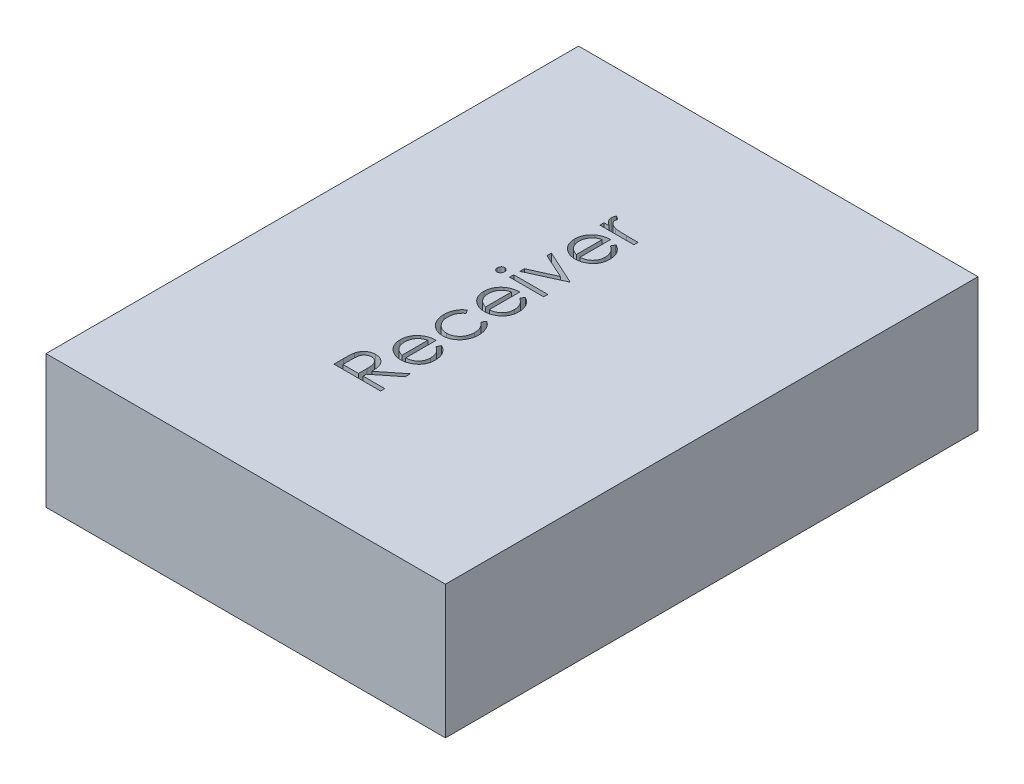
from build123d import *

# Parameters (mm, degrees)
SKETCH1_W           = 30
SKETCH1_H           = 40
BOSS_EXTRUDE1_DEPTH = 10
SKETCH2_W           = 2.557692308
SKETCH2_H           = 0.314102564
CUT_EXTRUDE1_DEPTH  = 2


with BuildPart() as part:
    # Sketch1 → Boss-Extrude1 (new body)
    with BuildSketch(Plane(origin=(0, 0, 0), x_dir=(1, 0, 0), z_dir=(0, 1, 0))):
        Rectangle(SKETCH1_W, SKETCH1_H)
    extrude(amount=BOSS_EXTRUDE1_DEPTH)

    # Sketch2 → Cut-Extrude1 (cut)
    # profile 1 of 9: a face of its own
    with BuildSketch(Plane(origin=(0, 10, 0), x_dir=(1, 0, 0), z_dir=(0, 1, 0))):
        with BuildLine():
            Line((-3.5, -9.871794872), (-3.5, -9.171374199))
            add(Edge.make_bspline(
                [(-3.5, -9.171374199), (-3.499844414, -9.12463307), (-3.499545672, -9.034884926), (-3.497879909, -8.906311655), (-3.493105553, -8.789484558), (-3.48899697, -8.684464719), (-3.481505028, -8.591254064), (-3.474344381, -8.509566773), (-3.46497072, -8.439779076), (-3.456265297, -8.397533225), (-3.452323718, -8.378405449)],
                knots=[0, 0, 0, 0, 1.410062039, 2.707475311, 3.878576406, 4.937260626, 5.877586885, 6.699081471, 7.410979367, 8, 8, 8, 8], degree=3))
            add(Edge.make_bspline(
                [(-3.452323718, -8.378405449), (-3.445996936, -8.352798844), (-3.433478338, -8.302131894), (-3.407018985, -8.22918154), (-3.376398448, -8.159668281), (-3.340438053, -8.093874571), (-3.298850926, -8.032153209), (-3.252429037, -7.973780871), (-3.201266149, -7.918947036), (-3.144901045, -7.868367331), (-3.084534666, -7.822423199), (-3.020332688, -7.782123119), (-2.952560575, -7.748070292), (-2.881112765, -7.721347564), (-2.806778508, -7.698924258), (-2.728799111, -7.683858559), (-2.647434893, -7.674474101), (-2.592073564, -7.673547009), (-2.564002404, -7.673076923)],
                knots=[0, 0, 0, 0, 1.02737844, 2.032840108, 3.019645024, 3.985760442, 4.950801802, 5.916702504, 6.889791722, 7.870143693, 8.864820395, 9.842884691, 10.820524757, 11.815201459, 12.812418953, 13.84314332, 14.906358105, 16, 16, 16, 16], degree=3))
            add(Edge.make_bspline(
                [(-2.564002404, -7.673076923), (-2.517367299, -7.674545921), (-2.426370131, -7.677412317), (-2.29430925, -7.704137421), (-2.171119935, -7.74791394), (-2.056957297, -7.808237229), (-1.954046652, -7.885056705), (-1.863656197, -7.977381496), (-1.788016284, -8.085263108), (-1.735563479, -8.185692424), (-1.701970571, -8.274406623), (-1.678334212, -8.347439936), (-1.660072247, -8.427106914), (-1.643712115, -8.512644248), (-1.63136042, -8.604407904), (-1.622313826, -8.702177943), (-1.616659777, -8.806024095), (-1.615817772, -8.877363164), (-1.615384615, -8.9140625)],
                knots=[0, 0, 0, 0, 1.260483769, 2.459530307, 3.627416485, 4.787058657, 5.939039949, 7.08810263, 8.267026773, 9.491475466, 10.141966685, 10.831826277, 11.566392101, 12.351337768, 13.187381173, 14.07005841, 15.007169909, 16, 16, 16, 16], degree=3))
            Line((-1.615384615, -8.9140625), (0, -7.628205128))
            Line((0, -7.628205128), (0, -8.016626603))
            Line((0, -8.016626603), (-1.615384615, -9.302483974))
            Line((-1.615384615, -9.302483974), (-1.615384615, -9.557692308))
            Line((-1.615384615, -9.557692308), (0, -9.557692308))
            Line((0, -9.557692308), (0, -9.871794872))
            Line((0, -9.871794872), (-3.5, -9.871794872))
        make_face()
        with BuildLine():
            Line((-3.141025641, -9.557692308), (-1.974358974, -9.557692308))
            Line((-1.974358974, -9.557692308), (-1.969451122, -8.916866987))
            add(Edge.make_bspline(
                [(-1.969451122, -8.916866987), (-1.969437877, -8.886946944), (-1.969412206, -8.82895338), (-1.973406086, -8.745052768), (-1.97794905, -8.666932476), (-1.984899579, -8.594892323), (-1.993851764, -8.52889678), (-2.005067425, -8.468989787), (-2.018078178, -8.415037813), (-2.038424454, -8.352317992), (-2.069251682, -8.281453612), (-2.117131907, -8.206123258), (-2.174663519, -8.140026916), (-2.242349925, -8.086196354), (-2.31558868, -8.041095114), (-2.395129884, -8.010743773), (-2.478393298, -7.990515893), (-2.535601748, -7.988304445), (-2.564703526, -7.987179487)],
                knots=[0, 0, 0, 0, 1.146477201, 2.22219935, 3.21835465, 4.145220026, 4.995151787, 5.769831222, 6.480173269, 7.120302478, 8.295254187, 9.430763426, 10.528629691, 11.636497428, 12.733230534, 13.811001502, 14.886462612, 16, 16, 16, 16], degree=3))
            add(Edge.make_bspline(
                [(-2.564703526, -7.987179487), (-2.592847804, -7.988385078), (-2.648619495, -7.990774119), (-2.730309052, -8.010172021), (-2.807431576, -8.043334675), (-2.880086643, -8.086960293), (-2.945007947, -8.14171063), (-3.001158697, -8.204675162), (-3.047125816, -8.27584177), (-3.077677228, -8.341770783), (-3.095618725, -8.401171504), (-3.108659167, -8.45250054), (-3.11770972, -8.510782617), (-3.126282244, -8.575752687), (-3.133221934, -8.647534743), (-3.138008837, -8.726339169), (-3.140812263, -8.811677799), (-3.14095286, -8.870824463), (-3.141025641, -8.901442308)],
                knots=[0, 0, 0, 0, 1.100823979, 2.181431445, 3.263702604, 4.376021382, 5.48638238, 6.575013887, 7.666064109, 8.791843368, 9.405226397, 10.093019944, 10.863016055, 11.711746407, 12.658404307, 13.684961631, 14.801597923, 16, 16, 16, 16], degree=3))
            Line((-3.141025641, -8.901442308), (-3.141025641, -9.557692308))
        make_face(mode=Mode.SUBTRACT)
    # profile 2 of 9: a face of its own
    with BuildSketch(Plane(origin=(0, 10, 0), x_dir=(1, 0, 0), z_dir=(0, 1, 0))):
        with BuildLine():
            Line((-0.807692308, -4.900841346), (-0.661157853, -4.621794872))
            add(Edge.make_bspline(
                [(-0.661157853, -4.621794872), (-0.621723871, -4.644043133), (-0.54500096, -4.687329438), (-0.439586991, -4.761466361), (-0.345319457, -4.839894828), (-0.26370785, -4.925001106), (-0.191634668, -5.014220583), (-0.129467518, -5.109247813), (-0.07608468, -5.209307149), (-0.032342426, -5.315500693), (0.002045853, -5.427701236), (0.027441832, -5.546559846), (0.042169086, -5.672637728), (0.043956532, -5.758975691), (0.044871795, -5.803185096)],
                knots=[0, 0, 0, 0, 1.120611642, 2.180266485, 3.186550691, 4.152466804, 5.095166165, 6.022949561, 6.960161436, 7.899497276, 8.862391909, 9.862399089, 10.905440174, 12, 12, 12, 12], degree=3))
            add(Edge.make_bspline(
                [(0.044871795, -5.803185096), (0.04372462, -5.852327074), (0.041486813, -5.948188835), (0.022194349, -6.087728583), (-0.009278012, -6.219107998), (-0.053243547, -6.342319716), (-0.110670893, -6.457061915), (-0.180630295, -6.563562966), (-0.26276285, -6.66238175), (-0.357778154, -6.750408775), (-0.459464338, -6.829642211), (-0.565404947, -6.899605791), (-0.675233097, -6.95782552), (-0.788295336, -7.0059075), (-0.90433474, -7.04383507), (-1.024015882, -7.070786986), (-1.146864189, -7.086180135), (-1.229959798, -7.088549549), (-1.271834936, -7.08974359)],
                knots=[0, 0, 0, 0, 1.14524686, 2.234044844, 3.276713788, 4.290115724, 5.276966211, 6.260758605, 7.254862358, 8.264742877, 9.274005885, 10.257798278, 11.220590477, 12.167824544, 13.118936889, 14.062732937, 15.023735098, 16, 16, 16, 16], degree=3))
            add(Edge.make_bspline(
                [(-1.271834936, -7.08974359), (-1.311129766, -7.088684448), (-1.389006931, -7.08658537), (-1.504272476, -7.073354583), (-1.616300928, -7.04990629), (-1.725185376, -7.017729966), (-1.83074351, -6.97617872), (-1.933039574, -6.9253465), (-2.031964713, -6.865154123), (-2.094367847, -6.818681449), (-2.125801282, -6.795272436)],
                knots=[0, 0, 0, 0, 1.024358464, 2.0301432, 3.019427413, 4.004406732, 4.986367066, 5.972626655, 6.978780325, 8, 8, 8, 8], degree=3))
            add(Edge.make_bspline(
                [(-2.125801282, -6.795272436), (-2.163732941, -6.763619417), (-2.238272838, -6.70141774), (-2.335322662, -6.595120979), (-2.418340489, -6.481571199), (-2.486066597, -6.359626225), (-2.538158683, -6.229491466), (-2.575211094, -6.091838148), (-2.598266796, -5.9462858), (-2.601109889, -5.846508073), (-2.602564103, -5.795472756)],
                knots=[0, 0, 0, 0, 1.030811313, 2.025658015, 2.997072178, 3.962767568, 4.930766827, 5.917075773, 6.934604948, 8, 8, 8, 8], degree=3))
            add(Edge.make_bspline(
                [(-2.602564103, -5.795472756), (-2.601216835, -5.743022135), (-2.598573804, -5.640125973), (-2.573851652, -5.490136462), (-2.535122917, -5.347934556), (-2.478696987, -5.214693774), (-2.408753193, -5.088361073), (-2.320347513, -4.971843985), (-2.218020567, -4.86194404), (-2.13924476, -4.798042155), (-2.099158654, -4.76552484)],
                knots=[0, 0, 0, 0, 1.056389096, 2.072394598, 3.055233004, 4.020130009, 4.981825462, 5.957811105, 6.960805292, 8, 8, 8, 8], degree=3))
            add(Edge.make_bspline(
                [(-2.099158654, -4.76552484), (-2.068955072, -4.743397901), (-2.008748954, -4.699291308), (-1.910577797, -4.644044208), (-1.807867202, -4.596086813), (-1.698956905, -4.557753852), (-1.585137325, -4.526714351), (-1.46559478, -4.504257532), (-1.340364869, -4.491087914), (-1.255038314, -4.488499216), (-1.211538462, -4.487179487)],
                knots=[0, 0, 0, 0, 0.94817472, 1.890038105, 2.849395472, 3.817997239, 4.812318967, 5.836947057, 6.897266129, 8, 8, 8, 8], degree=3))
            Line((-1.211538462, -4.487179487), (-1.211538462, -6.775641026))
            add(Edge.make_bspline(
                [(-1.211538462, -6.775641026), (-1.177837997, -6.774101419), (-1.111567394, -6.771073845), (-1.01459661, -6.756958702), (-0.922223268, -6.734709928), (-0.835140226, -6.703440866), (-0.752210099, -6.66557402), (-0.674048062, -6.619188304), (-0.601010132, -6.56384875), (-0.532442994, -6.50212305), (-0.471382233, -6.433415955), (-0.416730457, -6.361133208), (-0.37092486, -6.284239643), (-0.33374497, -6.203341559), (-0.304638654, -6.118569774), (-0.284770834, -6.029897579), (-0.271463727, -5.937499463), (-0.269984061, -5.874513729), (-0.269230769, -5.842447917)],
                knots=[0, 0, 0, 0, 1.094153842, 2.151609401, 3.174256925, 4.172055639, 5.149267565, 6.128595816, 7.11444997, 8.118368179, 9.117203808, 10.09244225, 11.054858984, 12.015122123, 12.976791628, 13.957293641, 14.960065497, 16, 16, 16, 16], degree=3))
            add(Edge.make_bspline(
                [(-0.269230769, -5.842447917), (-0.269833929, -5.811095401), (-0.271030715, -5.748885996), (-0.282834755, -5.656265289), (-0.301543133, -5.564984469), (-0.328488888, -5.475949929), (-0.360042003, -5.390459236), (-0.397179816, -5.310852818), (-0.439521127, -5.238183111), (-0.487636723, -5.169998776), (-0.546687196, -5.104221369), (-0.61966842, -5.037936859), (-0.707408148, -4.968431135), (-0.773006325, -4.924219098), (-0.807692308, -4.900841346)],
                knots=[0, 0, 0, 0, 0.991168677, 1.966668791, 2.94808785, 3.9350306, 4.905702032, 5.828266021, 6.709360349, 7.562606342, 8.463112863, 9.498839253, 10.677475166, 12, 12, 12, 12], degree=3))
        make_face()
        with BuildLine():
            add(Edge.make_bspline(
                [(-1.525641026, -4.801282051), (-1.567324719, -4.812732119), (-1.647343869, -4.83471253), (-1.75811233, -4.881523635), (-1.857124106, -4.932971684), (-1.942733842, -4.994905012), (-2.018888471, -5.06439183), (-2.084375044, -5.145762573), (-2.144732764, -5.2354881), (-2.194996376, -5.335355562), (-2.236300966, -5.441426684), (-2.266672607, -5.551521284), (-2.284525968, -5.664717221), (-2.287143515, -5.740957428), (-2.288461538, -5.779346955)],
                knots=[0, 0, 0, 0, 1.155085888, 2.217389643, 3.210301801, 4.133263417, 5.03575695, 5.95948047, 6.920061569, 7.923798377, 8.943125483, 9.960783337, 10.973185325, 12, 12, 12, 12], degree=3))
            add(Edge.make_bspline(
                [(-2.288461538, -5.779346955), (-2.287857, -5.810698789), (-2.286661954, -5.872674774), (-2.275088768, -5.96394123), (-2.256491944, -6.051816562), (-2.229148178, -6.136038468), (-2.195876219, -6.217165622), (-2.154978249, -6.295139403), (-2.105531888, -6.368957443), (-2.067760071, -6.415093615), (-2.048677885, -6.438401442)],
                knots=[0, 0, 0, 0, 1.048823158, 2.073302879, 3.073550078, 4.050623576, 5.03253758, 6.005186856, 6.992227572, 8, 8, 8, 8], degree=3))
            add(Edge.make_bspline(
                [(-2.048677885, -6.438401442), (-2.033585155, -6.45509734), (-2.00304115, -6.488885769), (-1.950387182, -6.533985457), (-1.893576633, -6.577488847), (-1.83012967, -6.616147948), (-1.761886187, -6.652887684), (-1.688348228, -6.68636711), (-1.609205387, -6.716808154), (-1.554028674, -6.733896557), (-1.525641026, -6.742688301)],
                knots=[0, 0, 0, 0, 0.879905587, 1.780714457, 2.708106151, 3.677566983, 4.684151534, 5.740052498, 6.837288539, 8, 8, 8, 8], degree=3))
            Line((-1.525641026, -6.742688301), (-1.525641026, -4.801282051))
        make_face(mode=Mode.SUBTRACT)
    # profile 3 of 9: a face of its own
    with BuildSketch(Plane(origin=(0, 10, 0), x_dir=(1, 0, 0), z_dir=(0, 1, 0))):
        with BuildLine():
            Line((-2.003104968, -1.346153846), (-1.83974359, -1.609074519))
            add(Edge.make_bspline(
                [(-1.83974359, -1.609074519), (-1.875571984, -1.637904385), (-1.946094094, -1.69465108), (-2.037104027, -1.793190316), (-2.115271069, -1.89820173), (-2.17897482, -2.011479778), (-2.22819627, -2.132865578), (-2.263026476, -2.261880429), (-2.284730719, -2.398505934), (-2.287197555, -2.492171133), (-2.288461538, -2.540164263)],
                knots=[0, 0, 0, 0, 1.026593902, 2.0206758, 2.988051866, 3.946915611, 4.916868779, 5.907761954, 6.927957743, 8, 8, 8, 8], degree=3))
            add(Edge.make_bspline(
                [(-2.288461538, -2.540164263), (-2.287404696, -2.57852322), (-2.285323274, -2.654070142), (-2.272312781, -2.764976296), (-2.248670773, -2.870618649), (-2.217519816, -2.971659358), (-2.175769526, -3.067379776), (-2.12495977, -3.158030695), (-2.06590973, -3.244416185), (-1.997499184, -3.324032926), (-1.923100516, -3.396861933), (-1.843346821, -3.459960847), (-1.76062693, -3.51489778), (-1.672875188, -3.558003737), (-1.582099134, -3.593278907), (-1.486585279, -3.616485627), (-1.387557271, -3.631950323), (-1.320038931, -3.633719652), (-1.285857372, -3.634615385)],
                knots=[0, 0, 0, 0, 1.112346261, 2.190735716, 3.231507886, 4.247384806, 5.251966152, 6.253067467, 7.256802811, 8.280671706, 9.291813951, 10.270744147, 11.225547591, 12.165006084, 13.100104208, 14.043489273, 15.009504848, 16, 16, 16, 16], degree=3))
            add(Edge.make_bspline(
                [(-1.285857372, -3.634615385), (-1.241094559, -3.632809166), (-1.151943011, -3.629211824), (-1.020567246, -3.60185125), (-0.89378287, -3.556069802), (-0.772275303, -3.494221188), (-0.65969093, -3.415714574), (-0.558704882, -3.323549825), (-0.471289548, -3.217628652), (-0.398816831, -3.098896897), (-0.340555516, -2.970138995), (-0.299048169, -2.832748934), (-0.273995801, -2.687849141), (-0.270839857, -2.588642396), (-0.269230769, -2.538060897)],
                knots=[0, 0, 0, 0, 0.96628757, 1.924499989, 2.884001032, 3.87047137, 4.860396324, 5.839257425, 6.814467993, 7.816059692, 8.834901047, 9.858382822, 10.908076205, 12, 12, 12, 12], degree=3))
            add(Edge.make_bspline(
                [(-0.269230769, -2.538060897), (-0.270530266, -2.491705713), (-0.273084123, -2.400605475), (-0.294613087, -2.26743819), (-0.32985672, -2.140658279), (-0.37900437, -2.020270248), (-0.442531886, -1.906494082), (-0.520891057, -1.800064907), (-0.611827657, -1.698864969), (-0.682145629, -1.639367992), (-0.717948718, -1.609074519)],
                knots=[0, 0, 0, 0, 1.039848629, 2.043578496, 3.018386758, 3.987534228, 4.954977003, 5.934852016, 6.948509513, 8, 8, 8, 8], degree=3))
            Line((-0.717948718, -1.609074519), (-0.545472756, -1.346153846))
            add(Edge.make_bspline(
                [(-0.545472756, -1.346153846), (-0.522582029, -1.361741548), (-0.476876553, -1.392865215), (-0.412432436, -1.444892841), (-0.352110754, -1.501012672), (-0.295992364, -1.561005769), (-0.242734345, -1.624088779), (-0.19488277, -1.692416689), (-0.149747947, -1.7637863), (-0.109135075, -1.839035458), (-0.072628754, -1.917386156), (-0.041237583, -1.998728146), (-0.014267477, -2.082707958), (0.00716987, -2.169424334), (0.024280708, -2.259048233), (0.03563441, -2.351347867), (0.044109691, -2.446291449), (0.044615558, -2.5104636), (0.044871795, -2.54296875)],
                knots=[0, 0, 0, 0, 0.954134338, 1.905101784, 2.851144739, 3.791306361, 4.734911809, 5.6936923, 6.663572882, 7.643865596, 8.638447847, 9.640600242, 10.646758161, 11.676244097, 12.717260333, 13.78922464, 14.880174919, 16, 16, 16, 16], degree=3))
            add(Edge.make_bspline(
                [(0.044871795, -2.54296875), (0.043979034, -2.592578985), (0.042229217, -2.689815405), (0.023041632, -2.832147069), (-0.005991844, -2.968127486), (-0.047309347, -3.097995621), (-0.101873852, -3.22095751), (-0.166998533, -3.338036815), (-0.244835572, -3.448025355), (-0.333535822, -3.550202081), (-0.429805581, -3.643642664), (-0.533088574, -3.724950666), (-0.641102547, -3.793856658), (-0.754528339, -3.850619162), (-0.87290085, -3.895002144), (-0.996943228, -3.925558247), (-1.125603037, -3.945274082), (-1.213334882, -3.947559371), (-1.2578125, -3.948717949)],
                knots=[0, 0, 0, 0, 1.113096611, 2.181677437, 3.217994567, 4.231807234, 5.234933164, 6.233258928, 7.234764453, 8.254006763, 9.267004511, 10.242118657, 11.199842941, 12.138404996, 13.084707599, 14.031460992, 15.002005182, 16, 16, 16, 16], degree=3))
            add(Edge.make_bspline(
                [(-1.2578125, -3.948717949), (-1.287990935, -3.948276933), (-1.348020822, -3.947399679), (-1.437115889, -3.937337751), (-1.525024434, -3.924339278), (-1.610632153, -3.902313541), (-1.695237443, -3.876872909), (-1.777820545, -3.844397377), (-1.858765217, -3.806301983), (-1.937862947, -3.763050035), (-2.013812487, -3.71436129), (-2.085566151, -3.660480057), (-2.153985917, -3.603435721), (-2.216709677, -3.540559609), (-2.276245869, -3.474519955), (-2.331003993, -3.403448379), (-2.381144984, -3.327752527), (-2.427595999, -3.248569205), (-2.468955434, -3.165944494), (-2.504588672, -3.080377823), (-2.535041248, -2.992384794), (-2.559150167, -2.90182465), (-2.579367591, -2.809298477), (-2.592085437, -2.714077139), (-2.60107171, -2.616524916), (-2.602062502, -2.550468894), (-2.602564103, -2.517027244)],
                knots=[0, 0, 0, 0, 0.990994727, 1.971252077, 2.943264845, 3.907940874, 4.872158414, 5.844625996, 6.82015047, 7.809835459, 8.804511986, 9.781214284, 10.756496977, 11.728388426, 12.696359165, 13.676225489, 14.672885716, 15.677705647, 16.690706858, 17.706033469, 18.721040654, 19.747369689, 20.783475414, 21.830280724, 22.901553713, 24, 24, 24, 24], degree=3))
            add(Edge.make_bspline(
                [(-2.602564103, -2.517027244), (-2.601642307, -2.475147083), (-2.599803323, -2.3915961), (-2.584323254, -2.267656166), (-2.560992168, -2.145538065), (-2.526399552, -2.027401753), (-2.484607014, -1.91461645), (-2.43739326, -1.809320902), (-2.38372785, -1.71310528), (-2.323939338, -1.62512091), (-2.255830681, -1.54539217), (-2.180095138, -1.471875587), (-2.096187562, -1.404086791), (-2.034388568, -1.3656242), (-2.003104968, -1.346153846)],
                knots=[0, 0, 0, 0, 1.095139042, 2.184804066, 3.262657822, 4.34424993, 5.400369085, 6.407210964, 7.359649996, 8.278719237, 9.185177137, 10.097389079, 11.036869154, 12, 12, 12, 12], degree=3))
        make_face()
    # profile 4 of 9: a face of its own
    with BuildSketch(Plane(origin=(0, 10, 0), x_dir=(1, 0, 0), z_dir=(0, 1, 0))):
        with BuildLine():
            Line((-0.807692308, 1.381209936), (-0.661157853, 1.66025641))
            add(Edge.make_bspline(
                [(-0.661157853, 1.66025641), (-0.621723871, 1.638008149), (-0.54500096, 1.594721844), (-0.439586991, 1.520584921), (-0.345319457, 1.442156454), (-0.26370785, 1.357050176), (-0.191634668, 1.267830699), (-0.129467518, 1.172803469), (-0.07608468, 1.072744133), (-0.032342426, 0.966550589), (0.002045853, 0.854350046), (0.027441832, 0.735491436), (0.042169086, 0.609413554), (0.043956532, 0.523075591), (0.044871795, 0.478866186)],
                knots=[0, 0, 0, 0, 1.120611642, 2.180266485, 3.186550691, 4.152466804, 5.095166165, 6.022949561, 6.960161436, 7.899497276, 8.862391909, 9.862399089, 10.905440174, 12, 12, 12, 12], degree=3))
            add(Edge.make_bspline(
                [(0.044871795, 0.478866186), (0.04372462, 0.429724208), (0.041486813, 0.333862447), (0.022194349, 0.194322699), (-0.009278012, 0.062943284), (-0.053243547, -0.060268434), (-0.110670893, -0.175010633), (-0.180630295, -0.281511684), (-0.26276285, -0.380330468), (-0.357778154, -0.468357493), (-0.459464338, -0.547590929), (-0.565404947, -0.617554509), (-0.675233097, -0.675774238), (-0.788295336, -0.723856218), (-0.90433474, -0.761783788), (-1.024015882, -0.788735704), (-1.146864189, -0.804128853), (-1.229959798, -0.806498267), (-1.271834936, -0.807692308)],
                knots=[0, 0, 0, 0, 1.14524686, 2.234044844, 3.276713788, 4.290115724, 5.276966211, 6.260758605, 7.254862358, 8.264742877, 9.274005885, 10.257798278, 11.220590477, 12.167824544, 13.118936889, 14.062732937, 15.023735098, 16, 16, 16, 16], degree=3))
            add(Edge.make_bspline(
                [(-1.271834936, -0.807692308), (-1.311129766, -0.806633166), (-1.389006931, -0.804534088), (-1.504272476, -0.791303301), (-1.616300928, -0.767855008), (-1.725185376, -0.735678684), (-1.83074351, -0.694127438), (-1.933039574, -0.643295218), (-2.031964713, -0.583102841), (-2.094367847, -0.536630167), (-2.125801282, -0.513221154)],
                knots=[0, 0, 0, 0, 1.024358464, 2.0301432, 3.019427413, 4.004406732, 4.986367066, 5.972626655, 6.978780325, 8, 8, 8, 8], degree=3))
            add(Edge.make_bspline(
                [(-2.125801282, -0.513221154), (-2.163732941, -0.481568135), (-2.238272838, -0.419366458), (-2.335322662, -0.313069697), (-2.418340489, -0.199519917), (-2.486066597, -0.077574943), (-2.538158683, 0.052559816), (-2.575211094, 0.190213134), (-2.598266796, 0.335765482), (-2.601109889, 0.435543209), (-2.602564103, 0.486578526)],
                knots=[0, 0, 0, 0, 1.030811313, 2.025658015, 2.997072178, 3.962767568, 4.930766827, 5.917075773, 6.934604948, 8, 8, 8, 8], degree=3))
            add(Edge.make_bspline(
                [(-2.602564103, 0.486578526), (-2.601216835, 0.539029147), (-2.598573804, 0.641925309), (-2.573851652, 0.79191482), (-2.535122917, 0.934116726), (-2.478696987, 1.067357508), (-2.408753193, 1.193690209), (-2.320347513, 1.310207297), (-2.218020567, 1.420107242), (-2.13924476, 1.484009127), (-2.099158654, 1.516526442)],
                knots=[0, 0, 0, 0, 1.056389096, 2.072394598, 3.055233004, 4.020130009, 4.981825462, 5.957811105, 6.960805292, 8, 8, 8, 8], degree=3))
            add(Edge.make_bspline(
                [(-2.099158654, 1.516526442), (-2.068955072, 1.538653381), (-2.008748954, 1.582759974), (-1.910577797, 1.638007074), (-1.807867202, 1.685964469), (-1.698956905, 1.72429743), (-1.585137325, 1.755336931), (-1.46559478, 1.77779375), (-1.340364869, 1.790963368), (-1.255038314, 1.793552066), (-1.211538462, 1.794871795)],
                knots=[0, 0, 0, 0, 0.94817472, 1.890038105, 2.849395472, 3.817997239, 4.812318967, 5.836947057, 6.897266129, 8, 8, 8, 8], degree=3))
            Line((-1.211538462, 1.794871795), (-1.211538462, -0.493589744))
            add(Edge.make_bspline(
                [(-1.211538462, -0.493589744), (-1.177837997, -0.492050137), (-1.111567394, -0.489022563), (-1.01459661, -0.47490742), (-0.922223268, -0.452658646), (-0.835140226, -0.421389584), (-0.752210099, -0.383522738), (-0.674048062, -0.337137022), (-0.601010132, -0.281797468), (-0.532442994, -0.220071768), (-0.471382233, -0.151364673), (-0.416730457, -0.079081926), (-0.37092486, -0.002188361), (-0.33374497, 0.078709723), (-0.304638654, 0.163481508), (-0.284770834, 0.252153703), (-0.271463727, 0.344551819), (-0.269984061, 0.407537553), (-0.269230769, 0.439603365)],
                knots=[0, 0, 0, 0, 1.094153842, 2.151609401, 3.174256925, 4.172055639, 5.149267565, 6.128595816, 7.11444997, 8.118368179, 9.117203808, 10.09244225, 11.054858984, 12.015122123, 12.976791628, 13.957293641, 14.960065497, 16, 16, 16, 16], degree=3))
            add(Edge.make_bspline(
                [(-0.269230769, 0.439603365), (-0.269833929, 0.470955881), (-0.271030715, 0.533165286), (-0.282834755, 0.625785993), (-0.301543133, 0.717066813), (-0.328488888, 0.806101353), (-0.360042003, 0.891592046), (-0.397179816, 0.971198464), (-0.439521127, 1.043868171), (-0.487636723, 1.112052506), (-0.546687196, 1.177829913), (-0.61966842, 1.244114423), (-0.707408148, 1.313620147), (-0.773006325, 1.357832184), (-0.807692308, 1.381209936)],
                knots=[0, 0, 0, 0, 0.991168677, 1.966668791, 2.94808785, 3.9350306, 4.905702032, 5.828266021, 6.709360349, 7.562606342, 8.463112863, 9.498839253, 10.677475166, 12, 12, 12, 12], degree=3))
        make_face()
        with BuildLine():
            add(Edge.make_bspline(
                [(-1.525641026, 1.480769231), (-1.567324719, 1.469319163), (-1.647343869, 1.447338752), (-1.75811233, 1.400527647), (-1.857124106, 1.349079598), (-1.942733842, 1.28714627), (-2.018888471, 1.217659452), (-2.084375044, 1.136288709), (-2.144732764, 1.046563182), (-2.194996376, 0.94669572), (-2.236300966, 0.840624599), (-2.266672607, 0.730529998), (-2.284525968, 0.617334061), (-2.287143515, 0.541093854), (-2.288461538, 0.502704327)],
                knots=[0, 0, 0, 0, 1.155085888, 2.217389643, 3.210301801, 4.133263417, 5.03575695, 5.95948047, 6.920061569, 7.923798377, 8.943125483, 9.960783337, 10.973185325, 12, 12, 12, 12], degree=3))
            add(Edge.make_bspline(
                [(-2.288461538, 0.502704327), (-2.287857, 0.471352493), (-2.286661954, 0.409376508), (-2.275088768, 0.318110052), (-2.256491944, 0.23023472), (-2.229148178, 0.146012814), (-2.195876219, 0.06488566), (-2.154978249, -0.013088121), (-2.105531888, -0.086906161), (-2.067760071, -0.133042333), (-2.048677885, -0.15635016)],
                knots=[0, 0, 0, 0, 1.048823158, 2.073302879, 3.073550078, 4.050623576, 5.03253758, 6.005186856, 6.992227572, 8, 8, 8, 8], degree=3))
            add(Edge.make_bspline(
                [(-2.048677885, -0.15635016), (-2.033585155, -0.173046058), (-2.00304115, -0.206834487), (-1.950387182, -0.251934175), (-1.893576633, -0.295437565), (-1.83012967, -0.334096666), (-1.761886187, -0.370836402), (-1.688348228, -0.404315828), (-1.609205387, -0.434756872), (-1.554028674, -0.451845274), (-1.525641026, -0.460637019)],
                knots=[0, 0, 0, 0, 0.879905587, 1.780714457, 2.708106151, 3.677566983, 4.684151534, 5.740052498, 6.837288539, 8, 8, 8, 8], degree=3))
            Line((-1.525641026, -0.460637019), (-1.525641026, 1.480769231))
        make_face(mode=Mode.SUBTRACT)
    # profile 5 of 9: a face of its own
    with BuildSketch(Plane(origin=(0, 10, 0), x_dir=(1, 0, 0), z_dir=(0, 1, 0))):
        with BuildLine():
            add(Edge.make_bspline(
                [(-3.634615385, 2.533854167), (-3.633711232, 2.553345482), (-3.631940728, 2.591513222), (-3.616779251, 2.64670649), (-3.591079566, 2.696963502), (-3.556599885, 2.741541235), (-3.516050441, 2.779793122), (-3.468789473, 2.806573832), (-3.417730834, 2.823786228), (-3.382115745, 2.825864783), (-3.363982372, 2.826923077)],
                knots=[0, 0, 0, 0, 1.055194115, 2.066272739, 3.074728998, 4.095836921, 5.109056067, 6.073838105, 7.019297344, 8, 8, 8, 8], degree=3))
            add(Edge.make_bspline(
                [(-3.363982372, 2.826923077), (-3.346319719, 2.825840917), (-3.311402744, 2.823701615), (-3.261229272, 2.806587127), (-3.214624988, 2.779564889), (-3.174154278, 2.741565763), (-3.139693658, 2.696957002), (-3.113988919, 2.646708217), (-3.098828782, 2.591512768), (-3.097058093, 2.553345329), (-3.096153846, 2.533854167)],
                knots=[0, 0, 0, 0, 0.96129708, 1.900370562, 2.859976407, 3.87933698, 4.906634145, 5.921202961, 6.938410037, 8, 8, 8, 8], degree=3))
            add(Edge.make_bspline(
                [(-3.096153846, 2.533854167), (-3.097023566, 2.514585891), (-3.098716363, 2.477082711), (-3.114286381, 2.422715869), (-3.139702454, 2.37288738), (-3.173928639, 2.328222707), (-3.214873536, 2.290992514), (-3.26120083, 2.263894188), (-3.311409985, 2.246819227), (-3.346322151, 2.244674598), (-3.363982372, 2.243589744)],
                knots=[0, 0, 0, 0, 1.054934014, 2.053291228, 3.073705704, 4.106921865, 5.123545215, 6.088680038, 7.033164197, 8, 8, 8, 8], degree=3))
            add(Edge.make_bspline(
                [(-3.363982372, 2.243589744), (-3.382113221, 2.24465083), (-3.417723354, 2.246734871), (-3.468818387, 2.263906987), (-3.515799889, 2.290766795), (-3.556825388, 2.328247359), (-3.591070823, 2.372880819), (-3.616481804, 2.422717564), (-3.632053144, 2.477082264), (-3.633745758, 2.51458574), (-3.634615385, 2.533854167)],
                knots=[0, 0, 0, 0, 0.98631895, 1.937192651, 2.907499808, 3.917963147, 4.944918757, 5.95915025, 6.951458133, 8, 8, 8, 8], degree=3))
        make_face()
    # profile 6 of 9: a face of its own
    with BuildSketch(Plane(origin=(0, 10, 0), x_dir=(1, 0, 0), z_dir=(0, 1, 0))):
        with Locations((-1.278846154, 2.53525641)):
            Rectangle(SKETCH2_W, SKETCH2_H)
    # profile 7 of 9: a face of its own
    with BuildSketch(Plane(origin=(0, 10, 0), x_dir=(1, 0, 0), z_dir=(0, 1, 0))):
        Polygon((-2.557692308, 3.141025641), (-2.557692308, 3.481069712), (-0.695512821, 4.330128205), (-2.557692308, 5.179186699), (-2.557692308, 5.519230769), (0, 4.352564103), (0, 4.307692308), align=None)
    # profile 8 of 9: a face of its own
    with BuildSketch(Plane(origin=(0, 10, 0), x_dir=(1, 0, 0), z_dir=(0, 1, 0))):
        with BuildLine():
            Line((-0.807692308, 8.201722756), (-0.661157853, 8.480769231))
            add(Edge.make_bspline(
                [(-0.661157853, 8.480769231), (-0.621723871, 8.45852097), (-0.54500096, 8.415234664), (-0.439586991, 8.341097742), (-0.345319457, 8.262669274), (-0.26370785, 8.177562997), (-0.191634668, 8.08834352), (-0.129467518, 7.993316289), (-0.07608468, 7.893256954), (-0.032342426, 7.78706341), (0.002045853, 7.674862866), (0.027441832, 7.556004257), (0.042169086, 7.429926375), (0.043956532, 7.343588412), (0.044871795, 7.299379006)],
                knots=[0, 0, 0, 0, 1.120611642, 2.180266485, 3.186550691, 4.152466804, 5.095166165, 6.022949561, 6.960161436, 7.899497276, 8.862391909, 9.862399089, 10.905440174, 12, 12, 12, 12], degree=3))
            add(Edge.make_bspline(
                [(0.044871795, 7.299379006), (0.04372462, 7.250237029), (0.041486813, 7.154375267), (0.022194349, 7.014835519), (-0.009278012, 6.883456105), (-0.053243547, 6.760244387), (-0.110670893, 6.645502187), (-0.180630295, 6.539001137), (-0.26276285, 6.440182352), (-0.357778154, 6.352155327), (-0.459464338, 6.272921891), (-0.565404947, 6.202958311), (-0.675233097, 6.144738583), (-0.788295336, 6.096656603), (-0.90433474, 6.058729033), (-1.024015882, 6.031777116), (-1.146864189, 6.016383968), (-1.229959798, 6.014014554), (-1.271834936, 6.012820513)],
                knots=[0, 0, 0, 0, 1.14524686, 2.234044844, 3.276713788, 4.290115724, 5.276966211, 6.260758605, 7.254862358, 8.264742877, 9.274005885, 10.257798278, 11.220590477, 12.167824544, 13.118936889, 14.062732937, 15.023735098, 16, 16, 16, 16], degree=3))
            add(Edge.make_bspline(
                [(-1.271834936, 6.012820513), (-1.311129766, 6.013879654), (-1.389006931, 6.015978732), (-1.504272476, 6.02920952), (-1.616300928, 6.052657813), (-1.725185376, 6.084834137), (-1.83074351, 6.126385383), (-1.933039574, 6.177217602), (-2.031964713, 6.23740998), (-2.094367847, 6.283882654), (-2.125801282, 6.307291667)],
                knots=[0, 0, 0, 0, 1.024358464, 2.0301432, 3.019427413, 4.004406732, 4.986367066, 5.972626655, 6.978780325, 8, 8, 8, 8], degree=3))
            add(Edge.make_bspline(
                [(-2.125801282, 6.307291667), (-2.163732941, 6.338944686), (-2.238272838, 6.401146363), (-2.335322662, 6.507443123), (-2.418340489, 6.620992903), (-2.486066597, 6.742937877), (-2.538158683, 6.873072636), (-2.575211094, 7.010725955), (-2.598266796, 7.156278303), (-2.601109889, 7.25605603), (-2.602564103, 7.307091346)],
                knots=[0, 0, 0, 0, 1.030811313, 2.025658015, 2.997072178, 3.962767568, 4.930766827, 5.917075773, 6.934604948, 8, 8, 8, 8], degree=3))
            add(Edge.make_bspline(
                [(-2.602564103, 7.307091346), (-2.601216835, 7.359541967), (-2.598573804, 7.462438129), (-2.573851652, 7.61242764), (-2.535122917, 7.754629547), (-2.478696987, 7.887870328), (-2.408753193, 8.01420303), (-2.320347513, 8.130720118), (-2.218020567, 8.240620063), (-2.13924476, 8.304521947), (-2.099158654, 8.337039263)],
                knots=[0, 0, 0, 0, 1.056389096, 2.072394598, 3.055233004, 4.020130009, 4.981825462, 5.957811105, 6.960805292, 8, 8, 8, 8], degree=3))
            add(Edge.make_bspline(
                [(-2.099158654, 8.337039263), (-2.068955072, 8.359166201), (-2.008748954, 8.403272794), (-1.910577797, 8.458519894), (-1.807867202, 8.506477289), (-1.698956905, 8.54481025), (-1.585137325, 8.575849751), (-1.46559478, 8.59830657), (-1.340364869, 8.611476189), (-1.255038314, 8.614064886), (-1.211538462, 8.615384615)],
                knots=[0, 0, 0, 0, 0.94817472, 1.890038105, 2.849395472, 3.817997239, 4.812318967, 5.836947057, 6.897266129, 8, 8, 8, 8], degree=3))
            Line((-1.211538462, 8.615384615), (-1.211538462, 6.326923077))
            add(Edge.make_bspline(
                [(-1.211538462, 6.326923077), (-1.177837997, 6.328462683), (-1.111567394, 6.331490257), (-1.01459661, 6.3456054), (-0.922223268, 6.367854174), (-0.835140226, 6.399123237), (-0.752210099, 6.436990082), (-0.674048062, 6.483375799), (-0.601010132, 6.538715353), (-0.532442994, 6.600441052), (-0.471382233, 6.669148148), (-0.416730457, 6.741430895), (-0.37092486, 6.81832446), (-0.33374497, 6.899222543), (-0.304638654, 6.983994328), (-0.284770834, 7.072666524), (-0.271463727, 7.16506464), (-0.269984061, 7.228050374), (-0.269230769, 7.260116186)],
                knots=[0, 0, 0, 0, 1.094153842, 2.151609401, 3.174256925, 4.172055639, 5.149267565, 6.128595816, 7.11444997, 8.118368179, 9.117203808, 10.09244225, 11.054858984, 12.015122123, 12.976791628, 13.957293641, 14.960065497, 16, 16, 16, 16], degree=3))
            add(Edge.make_bspline(
                [(-0.269230769, 7.260116186), (-0.269833929, 7.291468701), (-0.271030715, 7.353678107), (-0.282834755, 7.446298813), (-0.301543133, 7.537579634), (-0.328488888, 7.626614174), (-0.360042003, 7.712104866), (-0.397179816, 7.791711285), (-0.439521127, 7.864380992), (-0.487636723, 7.932565327), (-0.546687196, 7.998342734), (-0.61966842, 8.064627243), (-0.707408148, 8.134132968), (-0.773006325, 8.178345004), (-0.807692308, 8.201722756)],
                knots=[0, 0, 0, 0, 0.991168677, 1.966668791, 2.94808785, 3.9350306, 4.905702032, 5.828266021, 6.709360349, 7.562606342, 8.463112863, 9.498839253, 10.677475166, 12, 12, 12, 12], degree=3))
        make_face()
        with BuildLine():
            add(Edge.make_bspline(
                [(-1.525641026, 8.301282051), (-1.567324719, 8.289831983), (-1.647343869, 8.267851572), (-1.75811233, 8.221040468), (-1.857124106, 8.169592418), (-1.942733842, 8.107659091), (-2.018888471, 8.038172273), (-2.084375044, 7.956801529), (-2.144732764, 7.867076002), (-2.194996376, 7.76720854), (-2.236300966, 7.661137419), (-2.266672607, 7.551042818), (-2.284525968, 7.437846881), (-2.287143515, 7.361606674), (-2.288461538, 7.323217147)],
                knots=[0, 0, 0, 0, 1.155085888, 2.217389643, 3.210301801, 4.133263417, 5.03575695, 5.95948047, 6.920061569, 7.923798377, 8.943125483, 9.960783337, 10.973185325, 12, 12, 12, 12], degree=3))
            add(Edge.make_bspline(
                [(-2.288461538, 7.323217147), (-2.287857, 7.291865313), (-2.286661954, 7.229889329), (-2.275088768, 7.138622873), (-2.256491944, 7.05074754), (-2.229148178, 6.966525634), (-2.195876219, 6.885398481), (-2.154978249, 6.8074247), (-2.105531888, 6.733606659), (-2.067760071, 6.687470488), (-2.048677885, 6.66416266)],
                knots=[0, 0, 0, 0, 1.048823158, 2.073302879, 3.073550078, 4.050623576, 5.03253758, 6.005186856, 6.992227572, 8, 8, 8, 8], degree=3))
            add(Edge.make_bspline(
                [(-2.048677885, 6.66416266), (-2.033585155, 6.647466762), (-2.00304115, 6.613678333), (-1.950387182, 6.568578646), (-1.893576633, 6.525075256), (-1.83012967, 6.486416155), (-1.761886187, 6.449676418), (-1.688348228, 6.416196993), (-1.609205387, 6.385755949), (-1.554028674, 6.368667546), (-1.525641026, 6.359875801)],
                knots=[0, 0, 0, 0, 0.879905587, 1.780714457, 2.708106151, 3.677566983, 4.684151534, 5.740052498, 6.837288539, 8, 8, 8, 8], degree=3))
            Line((-1.525641026, 6.359875801), (-1.525641026, 8.301282051))
        make_face(mode=Mode.SUBTRACT)
    # profile 9 of 9: a face of its own
    with BuildSketch(Plane(origin=(0, 10, 0), x_dir=(1, 0, 0), z_dir=(0, 1, 0))):
        with BuildLine():
            Line((-2.557692308, 9.153846154), (-2.557692308, 9.467948718))
            Line((-2.557692308, 9.467948718), (-2.181189904, 9.467948718))
            add(Edge.make_bspline(
                [(-2.181189904, 9.467948718), (-2.216261426, 9.49112264), (-2.283335439, 9.535442584), (-2.371926058, 9.609452402), (-2.446113212, 9.684451976), (-2.504482141, 9.762410658), (-2.548594798, 9.842564123), (-2.57959138, 9.92423648), (-2.598813304, 10.007627447), (-2.601312162, 10.063802909), (-2.602564103, 10.091947115)],
                knots=[0, 0, 0, 0, 1.280091057, 2.448164201, 3.510831157, 4.48793739, 5.405868014, 6.289422536, 7.142991551, 8, 8, 8, 8], degree=3))
            add(Edge.make_bspline(
                [(-2.602564103, 10.091947115), (-2.601373576, 10.113773442), (-2.59892399, 10.158682527), (-2.581713165, 10.226665117), (-2.554235143, 10.296708569), (-2.52839492, 10.341850956), (-2.514923878, 10.365384615)],
                knots=[0, 0, 0, 0, 0.901110191, 1.854092781, 2.881294221, 4, 4, 4, 4], degree=3))
            Line((-2.514923878, 10.365384615), (-2.242888622, 10.192908654))
            add(Edge.make_bspline(
                [(-2.242888622, 10.192908654), (-2.249628888, 10.177799633), (-2.262423203, 10.149119818), (-2.277565213, 10.107165252), (-2.286481129, 10.068483915), (-2.287831847, 10.043840357), (-2.288461538, 10.032351763)],
                knots=[0, 0, 0, 0, 1.180555205, 2.24091978, 3.179933427, 4, 4, 4, 4], degree=3))
            add(Edge.make_bspline(
                [(-2.288461538, 10.032351763), (-2.286794658, 10.007138462), (-2.283394705, 9.955710636), (-2.256284039, 9.880459302), (-2.213741221, 9.806783927), (-2.165297528, 9.748835693), (-2.118763125, 9.703808829), (-2.078035261, 9.671426651), (-2.031944456, 9.642363163), (-1.982272224, 9.614170809), (-1.927771932, 9.587977984), (-1.868354671, 9.564570846), (-1.804511084, 9.542680666), (-1.76011915, 9.530353126), (-1.737379808, 9.524038462)],
                knots=[0, 0, 0, 0, 1.125322384, 2.295331465, 3.535939348, 4.916963136, 5.656144286, 6.429838446, 7.238666481, 8.090384391, 8.983239461, 9.940052224, 10.944811494, 12, 12, 12, 12], degree=3))
            add(Edge.make_bspline(
                [(-1.737379808, 9.524038462), (-1.717103757, 9.519297889), (-1.671968634, 9.508745228), (-1.596591234, 9.498758835), (-1.507592607, 9.488494452), (-1.404869363, 9.481484911), (-1.288026631, 9.474863465), (-1.157568472, 9.471205506), (-1.013136318, 9.468065101), (-0.912395458, 9.46798875), (-0.859575321, 9.467948718)],
                knots=[0, 0, 0, 0, 0.566841273, 1.261806378, 2.068780918, 3.007109044, 4.065315289, 5.256255371, 6.561408263, 8, 8, 8, 8], degree=3))
            Line((-0.859575321, 9.467948718), (0, 9.467948718))
            Line((0, 9.467948718), (0, 9.153846154))
            Line((0, 9.153846154), (-2.557692308, 9.153846154))
        make_face()
    extrude(amount=-CUT_EXTRUDE1_DEPTH, mode=Mode.SUBTRACT)


solid = part.part
